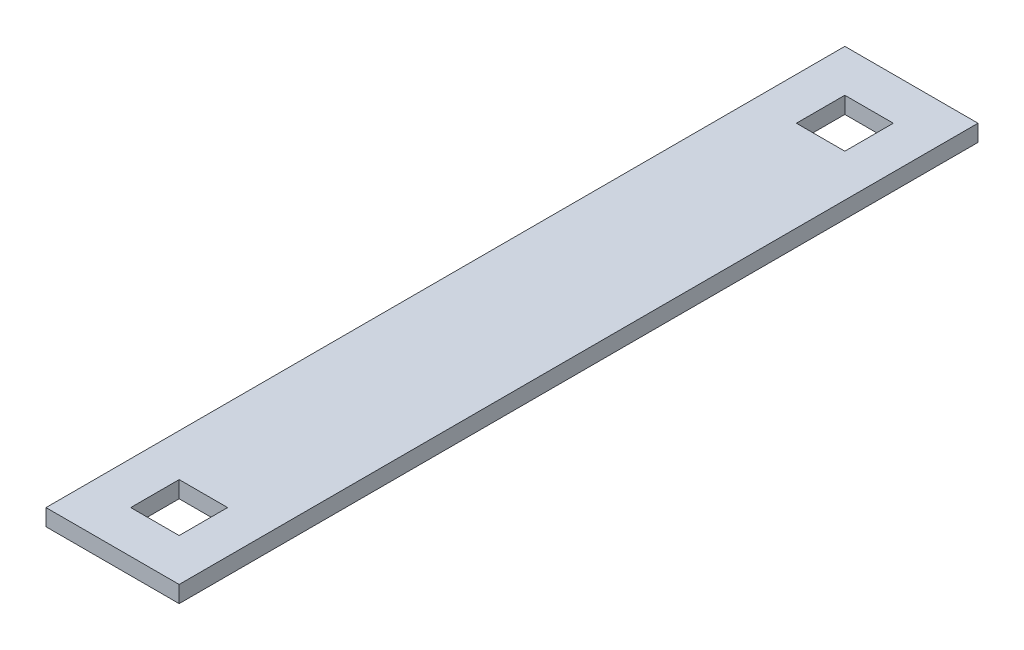
from build123d import *

# Parameters (mm, degrees)
SKETCH1_W           = 12.7
SKETCH1_H           = 76.2
SKETCH1_W_2         = 4.6228
SKETCH1_H_2         = 4.6228
SKETCH1_W_3         = 4.62
BOSS_EXTRUDE1_DEPTH = 1.5875


with BuildPart() as part:
    # Sketch1 → Boss-Extrude1 (new body)
    with BuildSketch(Plane(origin=(0, 0, 0), x_dir=(1, 0, 0), z_dir=(0, 1, 0))):
        with Locations((6.35, 63.437542426)):
            Rectangle(SKETCH1_W, SKETCH1_H)
        with Locations((6.3486, 95.186142426)):
            Rectangle(SKETCH1_W_2, SKETCH1_H_2, mode=Mode.SUBTRACT)
        with Locations((6.35, 31.688942426)):
            Rectangle(SKETCH1_W_3, SKETCH1_H_2, mode=Mode.SUBTRACT)
    extrude(amount=BOSS_EXTRUDE1_DEPTH)


solid = part.part
